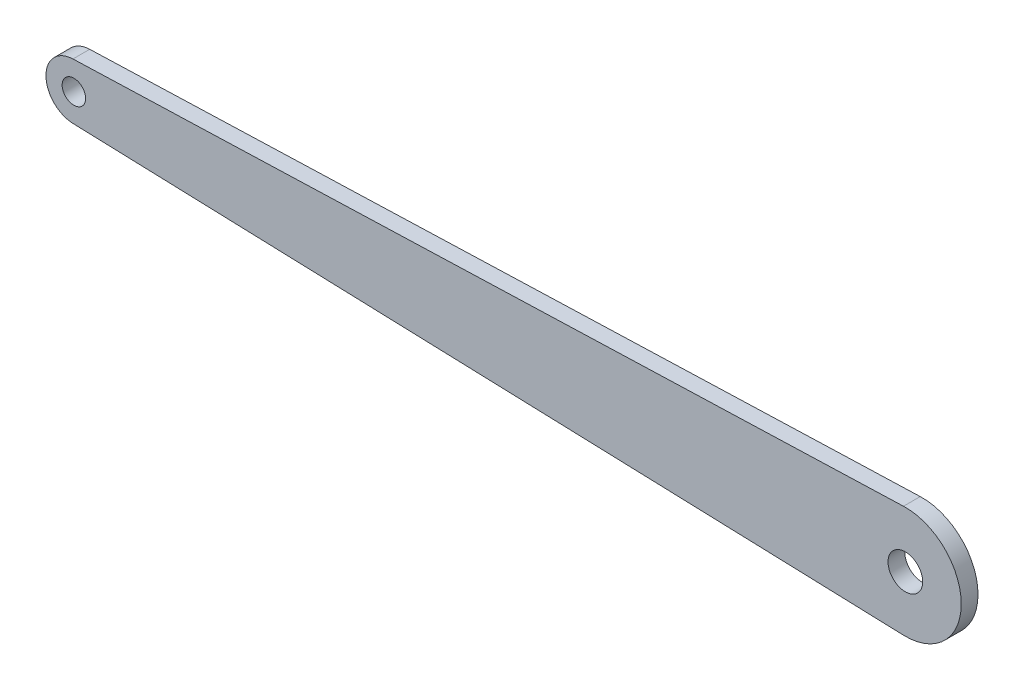
from build123d import *

# Parameters (mm, degrees)
SKETCH_1_R      = 3.1
SKETCH_1_R_2    = 2.1
EXTRUDE_1_DEPTH = 3


with BuildPart() as part:
    # 草图1 → 凸台-拉伸1 (new body)
    with BuildSketch(Plane(origin=(0, 0, -59.111716595), x_dir=(-1, 0, 0), z_dir=(0, 0, -1))):
        with BuildLine():
            Line((231.225670337, 122.793400157), (82.573658511, 127.790577357))
            ThreePointArc((82.573658511, 127.790577357), (72.237682163, 117.796222956), (82.573658511, 107.801868555))
            Line((82.573658511, 107.801868555), (231.225670337, 112.799045756))
            ThreePointArc((231.225670337, 112.799045756), (236.057682163, 117.796222956), (231.225670337, 122.793400157))
        make_face()
        with Locations((82.237682163, 117.796222956)):
            Circle(SKETCH_1_R, mode=Mode.SUBTRACT)
        with Locations((231.057682163, 117.796222956)):
            Circle(SKETCH_1_R_2, mode=Mode.SUBTRACT)
    extrude(amount=EXTRUDE_1_DEPTH)


solid = part.part
